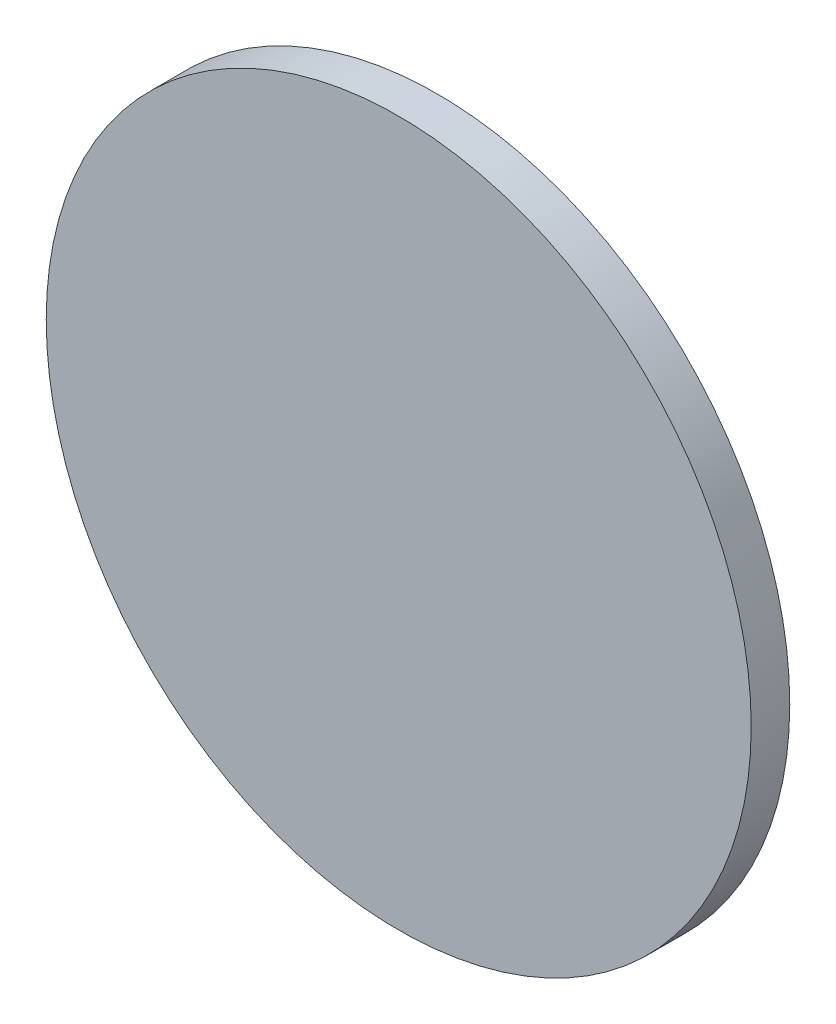
from build123d import *

# Parameters (mm, degrees)
SKETCH1_R           = 64
BOSS_EXTRUDE1_DEPTH = 7


with BuildPart() as part:
    # Sketch1 → Boss-Extrude1 (new body)
    with BuildSketch(Plane.XY):
        Circle(SKETCH1_R)
    extrude(amount=BOSS_EXTRUDE1_DEPTH)


solid = part.part
